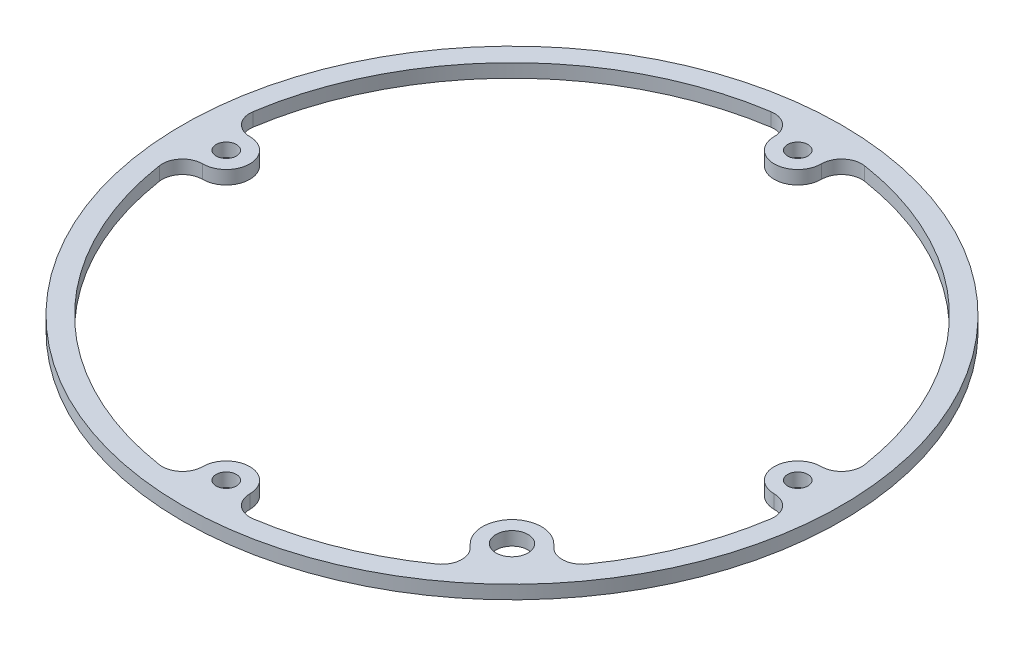
from build123d import *

# Parameters (mm, degrees)
SKETCH1_R           = 48.9
SKETCH1_R_2         = 45.9
BOSS_EXTRUDE1_DEPTH = 2
SKETCH2_R           = 1.5
BOSS_EXTRUDE2_DEPTH = 2
SKETCH3_R           = 2.38125
BOSS_EXTRUDE3_DEPTH = 2
FILLET1_R           = 3


with BuildPart() as part:
    # Sketch1 → Boss-Extrude1 (new body)
    with BuildSketch(Plane(origin=(0, 0, 0), x_dir=(1, 0, 0), z_dir=(0, 1, 0))):
        with Locations(Location((0, 0, 0), (0, 0, 270))):
            Circle(SKETCH1_R)
        with Locations(Location((0, 0, 0), (0, 0, 270))):
            Circle(SKETCH1_R_2, mode=Mode.SUBTRACT)
    extrude(amount=BOSS_EXTRUDE1_DEPTH)

    # Sketch2 → Boss-Extrude2 (add)
    # profile 1 of 4: a face of its own
    with BuildSketch(Plane.XZ):
        with BuildLine():
            Line((-3.5, 45.766363194), (-3.5, 42.4))
            ThreePointArc((-3.5, 42.4), (0, 38.9), (3.5, 42.4))
            Line((3.5, 42.4), (3.5, 45.766363194))
            ThreePointArc((3.5, 45.766363194), (0, 45.9), (-3.5, 45.766363194))
        make_face()
        with Locations(Location((0, 42.4, 0), (0, 0, 270))):
            Circle(SKETCH2_R, mode=Mode.SUBTRACT)
    # profile 2 of 4: a face of its own
    with BuildSketch(Plane.XZ):
        with BuildLine():
            ThreePointArc((45.9, 0), (45.866578631, 1.751275164), (45.766363194, 3.5))
            Line((45.766363194, 3.5), (42.4, 3.5))
            ThreePointArc((42.4, 3.5), (38.9, 0), (42.4, -3.5))
            Line((42.4, -3.5), (45.766363194, -3.5))
            ThreePointArc((45.766363194, -3.5), (45.866578631, -1.751275164), (45.9, 0))
        make_face()
        with Locations(Location((42.4, 0, 0), (0, 0, 270))):
            Circle(SKETCH2_R, mode=Mode.SUBTRACT)
    # profile 3 of 4: a face of its own
    with BuildSketch(Plane.XZ):
        with BuildLine():
            Line((-3.5, -42.4), (-3.5, -45.766363194))
            ThreePointArc((-3.5, -45.766363194), (0, -45.9), (3.5, -45.766363194))
            Line((3.5, -45.766363194), (3.5, -42.4))
            ThreePointArc((3.5, -42.4), (0, -38.9), (-3.5, -42.4))
        make_face()
        with Locations(Location((0, -42.4, 0), (0, 0, 270))):
            Circle(SKETCH2_R, mode=Mode.SUBTRACT)
    # profile 4 of 4: a face of its own
    with BuildSketch(Plane.XZ):
        with BuildLine():
            Line((-42.4, 3.5), (-45.766363194, 3.5))
            ThreePointArc((-45.766363194, 3.5), (-45.9, 0), (-45.766363194, -3.5))
            Line((-45.766363194, -3.5), (-42.4, -3.5))
            ThreePointArc((-42.4, -3.5), (-38.9, 0), (-42.4, 3.5))
        make_face()
        with Locations(Location((-42.4, 0, 0), (0, 0, 270))):
            Circle(SKETCH2_R, mode=Mode.SUBTRACT)
    extrude(amount=-BOSS_EXTRUDE2_DEPTH)

    # Sketch3 → Boss-Extrude3 (add)
    with BuildSketch(Plane.XZ):
        with BuildLine():
            ThreePointArc((35.406018707, 29.209995537), (32.456201256, 32.456201256), (29.209995537, 35.406018707))
            Line((29.209995537, 35.406018707), (26.260178086, 32.456201256))
            ThreePointArc((26.260178086, 32.456201256), (26.260178086, 26.260178086), (32.456201256, 26.260178086))
            Line((32.456201256, 26.260178086), (35.406018707, 29.209995537))
        make_face()
        with Locations(Location((29.358189671, 29.358189671, 0), (0, 0, 270))):
            Circle(SKETCH3_R, mode=Mode.SUBTRACT)
    extrude(amount=-BOSS_EXTRUDE3_DEPTH)

    # Fillet1
    fillet1_edges = [part.edges().sort_by_distance(p)[0] for p in [
        (3.5, 1, 45.766363194),
        (-3.5, 1, 45.766363194),
        (45.766363194, 1, -3.5),
        (45.766363194, 1, 3.5),
        (-3.5, 1, -45.766363194),
        (3.5, 1, -45.766363194),
        (-45.766363194, 1, 3.5),
        (-45.766363194, 1, -3.5),
        (35.406018707, 1, 29.209995537),
        (29.209995537, 1, 35.406018707),
    ]]
    fillet(fillet1_edges, radius=FILLET1_R)


solid = part.part
